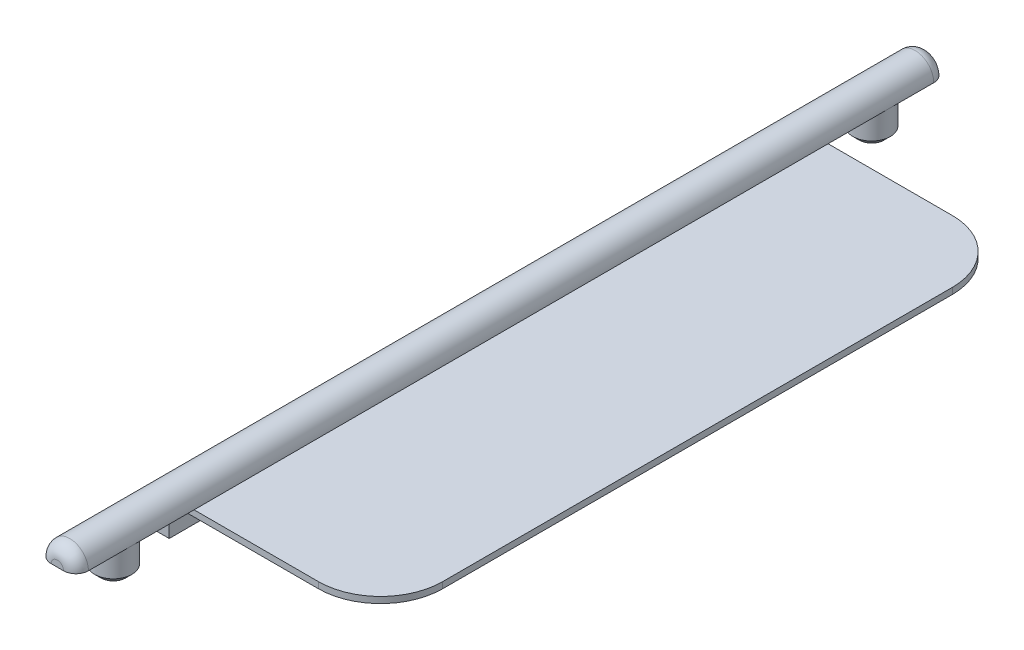
from build123d import *

# Parameters (mm, degrees)
EXTRUDE_2_DEPTH     = 140
SKETCH_4_W          = 6
SKETCH_4_H          = 19
CUT_EXTRUDE_1_DEPTH = 1
SKETCH_3_R          = 3
EXTRUDE_4_DEPTH     = 5
CHAMFER_2_SIZE      = 1
FILLET_2_R          = 2
SKETCH_6_W          = 102
SKETCH_6_H          = 1
EXTRUDE_5_DEPTH     = 30
FILLET_3_R          = 10
SKETCH_7_W          = 2
SKETCH_7_H          = 102
EXTRUDE_6_DEPTH     = 5


with BuildPart() as part:
    # 草图2 → 凸台-拉伸2 (new body)
    with BuildSketch(Plane.XY):
        with BuildLine():
            Line((-3, 0), (3, 0))
            Line((3, 0), (3, 1))
            ThreePointArc((3, 1), (0, 4), (-3, 1))
            Line((-3, 1), (-3, 0))
        make_face()
    extrude(amount=EXTRUDE_2_DEPTH)

    # 草图4 → 切除-拉伸1 (cut)
    with BuildSketch(Plane.XZ):
        with Locations((0, 130.5)):
            Rectangle(SKETCH_4_W, SKETCH_4_H)
        with Locations((0, 9.5)):
            Rectangle(SKETCH_4_W, SKETCH_4_H)
    extrude(amount=-CUT_EXTRUDE_1_DEPTH, mode=Mode.SUBTRACT)

    # 草图3 → 凸台-拉伸4 (add)
    with BuildSketch(Plane.XZ.offset(-1)):
        with Locations(Location((0, 131, 0), (0, 0, 180))):
            Circle(SKETCH_3_R)
        with Locations(Location((0, 9, 0), (0, 0, 180))):
            Circle(SKETCH_3_R)
    extrude(amount=EXTRUDE_4_DEPTH)

    # 倒角2
    chamfer_2_edges = [part.edges().sort_by_distance(p)[0] for p in [
        (3, -4, 131),
        (3, -4, 9),
    ]]
    chamfer(chamfer_2_edges, length=CHAMFER_2_SIZE)

    # 圆角2
    fillet_2_edges = [part.edges().sort_by_distance(p)[0] for p in [
        (0, 4, 140),
        (0, 4, 0),
    ]]
    fillet(fillet_2_edges, radius=FILLET_2_R)

    # 草图6 → 凸台-拉伸5 (add)
    with BuildSketch(Plane(origin=(3, 0, 0), x_dir=(0, 0, -1), z_dir=(1, 0, 0))):
        with Locations((-70, 0.5)):
            Rectangle(SKETCH_6_W, SKETCH_6_H)
    extrude(amount=EXTRUDE_5_DEPTH)

    # 圆角3
    fillet_3_edges = [part.edges().sort_by_distance(p)[0] for p in [
        (33, 0.5, 121),
        (33, 0.5, 19),
    ]]
    fillet(fillet_3_edges, radius=FILLET_3_R)

    # 草图7 → 凸台-拉伸6 (add)
    with BuildSketch(Plane.XZ):
        with Locations((-2, 70)):
            Rectangle(SKETCH_7_W, SKETCH_7_H)
    extrude(amount=EXTRUDE_6_DEPTH)


solid = part.part
